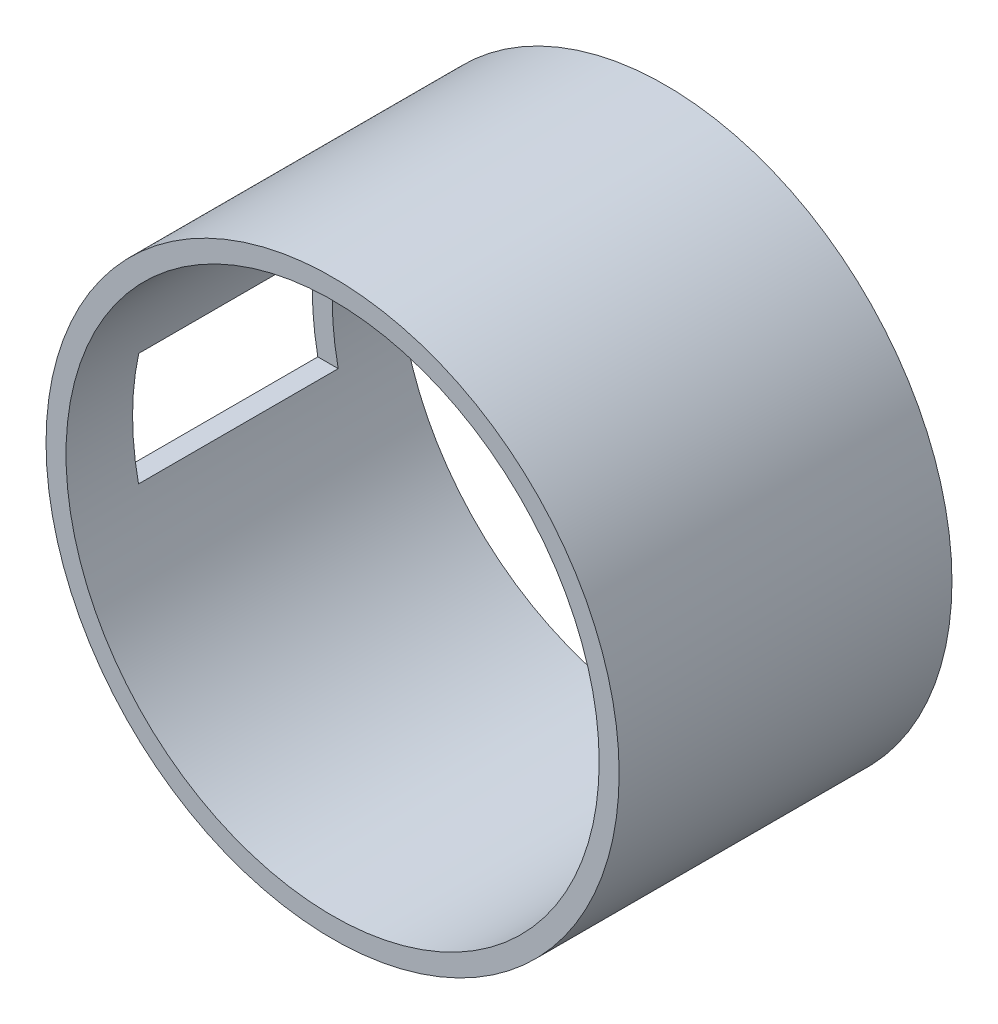
from build123d import *

# Parameters (mm, degrees)
SKETCH_1_R          = 8.61
SKETCH_1_R_2        = 8.01
EXTRUDE_1_DEPTH     = 10
SKETCH_3_W          = 6
SKETCH_3_H          = 3.4
CUT_EXTRUDE_1_DEPTH = 1.5


with BuildPart() as part:
    # 草图1 → 凸台-拉伸1 (new body)
    with BuildSketch(Plane.XY):
        Circle(SKETCH_1_R)
        Circle(SKETCH_1_R_2, mode=Mode.SUBTRACT)
    extrude(amount=EXTRUDE_1_DEPTH)

    # 草图3 → 切除-拉伸1 (cut)
    with BuildSketch(Plane.ZY.offset(8.61)):
        with Locations((5, 0.014841624)):
            Rectangle(SKETCH_3_W, SKETCH_3_H)
    extrude(amount=-CUT_EXTRUDE_1_DEPTH, mode=Mode.SUBTRACT)


solid = part.part
